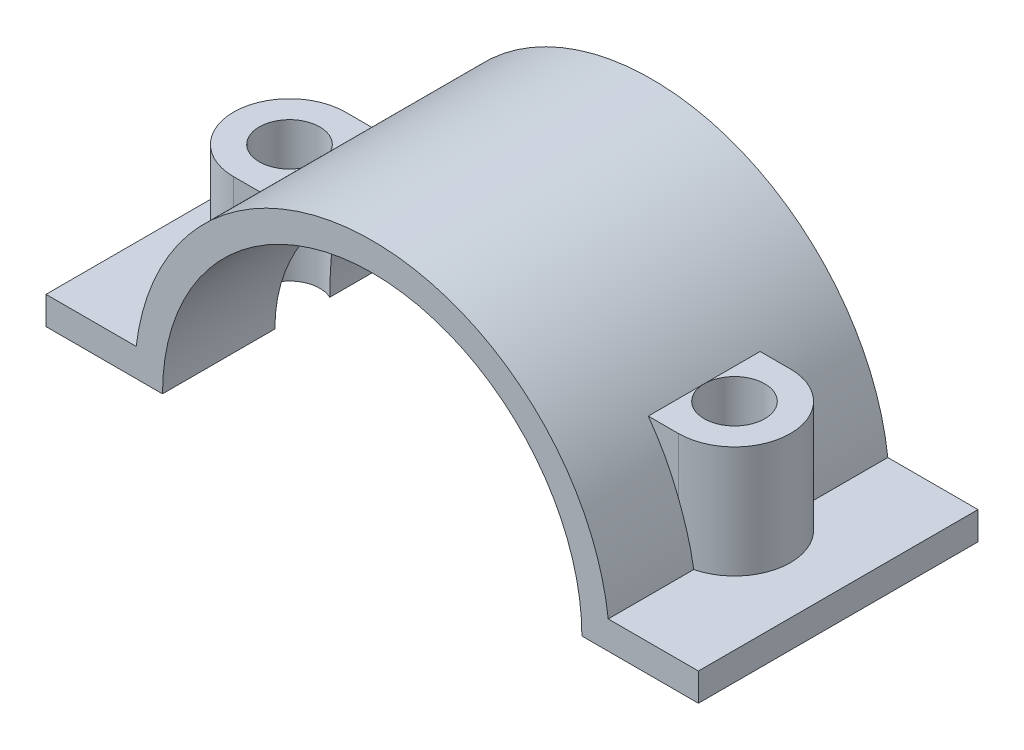
from build123d import *

# Parameters (mm, degrees)
BOSS_EXTRUDE4_DEPTH = 15
BOSS_EXTRUDE5_REACH = 42.927
SKETCH8_R           = 3.25
CUT_EXTRUDE1_DEPTH  = 41.926763896


with BuildPart() as part:
    # Sketch2 → Boss-Extrude4 (new, symmetric)
    with BuildSketch(Plane.XY):
        with BuildLine():
            Line((-22.5, 0), (-35, 0))
            Line((-35, 0), (-35, 3))
            Line((-35, 3), (-25.322914524, 3))
            ThreePointArc((-25.322914524, 3), (0, 25.5), (25.322914524, 3))
            Line((25.322914524, 3), (35, 3))
            Line((35, 3), (35, 0))
            Line((35, 0), (22.5, 0))
            ThreePointArc((22.5, 0), (0, 22.5), (-22.5, 0))
        make_face()
    extrude(amount=BOSS_EXTRUDE4_DEPTH, both=True)

    # Sketch5 → Boss-Extrude5 (add, up to next)
    with BuildSketch(Plane(origin=(0, 15, 0), x_dir=(1, 0, 0), z_dir=(0, 1, 0)), mode=Mode.PRIVATE) as boss_extrude5_sk1:
        with BuildLine():
            Line((-23.872753943, 6), (-13.872753943, 6))
            Line((-13.872753943, 6), (-13.872753943, -6))
            Line((-13.872753943, -6), (-23.872753943, -6))
            ThreePointArc((-23.872753943, -6), (-29.872753943, 0), (-23.872753943, 6))
        make_face()
    boss_extrude5_tool1 = extrude(boss_extrude5_sk1.sketch, amount=-BOSS_EXTRUDE5_REACH, mode=Mode.PRIVATE) - part.part
    boss_extrude5 = boss_extrude5_tool1.solids().sort_by_distance((-21.289897, 15, 0))[0]
    add(boss_extrude5)

    # Sketch8 → Cut-Extrude1 (cut, through all)
    with BuildSketch(Plane(origin=(0, 15, 0), x_dir=(1, 0, 0), z_dir=(0, 1, 0))):
        with Locations(Location((-23.872753943, 0, 0), (0, 0, 270))):
            Circle(SKETCH8_R)
    cut_extrude1 = extrude(amount=-CUT_EXTRUDE1_DEPTH, mode=Mode.SUBTRACT)

    # Mirror1: Boss-Extrude5 across plane
    add(boss_extrude5.mirror(Plane(origin=(0, 0, 0), x_dir=(0, 0, 1), z_dir=(1, 0, 0))))

    # Mirror2: Cut-Extrude1 across plane
    add(cut_extrude1.mirror(Plane(origin=(0, 0, 0), x_dir=(0, 0, 1), z_dir=(1, 0, 0))), mode=Mode.SUBTRACT)


solid = part.part
